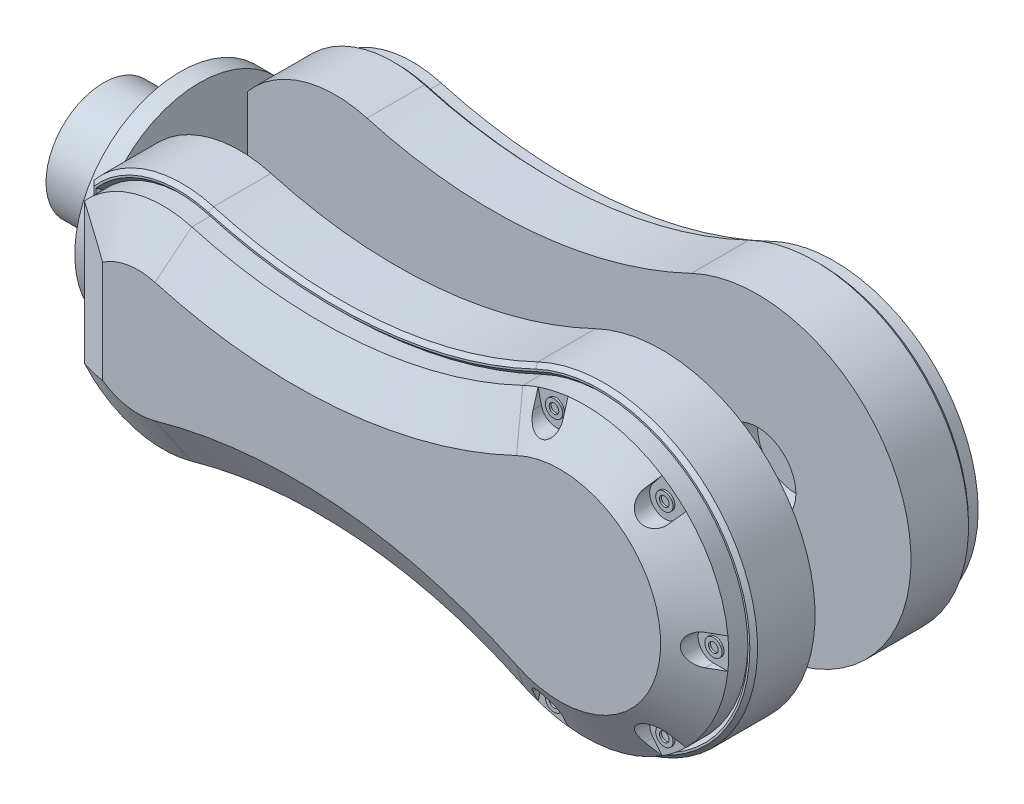
from build123d import *

# Parameters (mm, degrees)
SKETCH1_R                 = 27.5
BOSS_EXTRUDE1_DEPTH       = 5
BOSS_EXTRUDE2_DEPTH       = 15
BOSS_EXTRUDE3_DEPTH       = 5
BOSS_EXTRUDE4_DEPTH       = 1
BOSS_EXTRUDE4_DRAFT       = 45
BOSS_EXTRUDE5_DEPTH       = 6.5
BOSS_EXTRUDE5_TAPER       = 60
CUT_EXTRUDE1_START        = -6.5
CUT_EXTRUDE1_DEPTH        = 6.5
SKETCH10_R                = 2.25
SKETCH10_R_2              = 1.25
BOSS_EXTRUDE6_DEPTH       = 0.5
CIRPATTERN1_COUNT         = 7
MIRROR1_COPY_1_DEPTH      = 1
MIRROR1_COPY_1_DRAFT      = 45
MIRROR1_START             = -6.5
MIRROR1_COPY_2_DEPTH      = 6.5
MIRROR1_COPY_3_DEPTH      = 6.5
MIRROR1_COPY_4_DEPTH      = 6.5
MIRROR1_COPY_5_DEPTH      = 6.5
MIRROR1_COPY_6_SKETCH_R   = 2.25
MIRROR1_COPY_6_SKETCH_R_2 = 1.25
MIRROR1_COPY_6_DEPTH      = 0.5
MIRROR1_COPY_7_SKETCH_R   = 2.25
MIRROR1_COPY_7_SKETCH_R_2 = 1.25
MIRROR1_COPY_7_DEPTH      = 0.5
MIRROR1_COPY_8_SKETCH_R   = 2.25
MIRROR1_COPY_8_SKETCH_R_2 = 1.25
MIRROR1_COPY_8_DEPTH      = 0.5
MIRROR1_COPY_9_SKETCH_R   = 2.25
MIRROR1_COPY_9_SKETCH_R_2 = 1.25
MIRROR1_COPY_9_DEPTH      = 0.5
SKETCH11_R                = 15
BOSS_EXTRUDE7_DEPTH       = 20
SKETCH12_R                = 10
CUT_EXTRUDE2_DEPTH        = 10


with BuildPart() as part:
    # Sketch1 → Boss-Extrude1 (new body)
    with BuildSketch(Plane(origin=(0, 0, 0), x_dir=(0, 0, -1), z_dir=(1, 0, 0))):
        Circle(SKETCH1_R)
    extrude(amount=BOSS_EXTRUDE1_DEPTH)

    # Sketch2 → Boss-Extrude2 (add)
    with BuildSketch(Plane.XY.offset(27.5)):
        with BuildLine():
            Line((5, -19.261360284), (5, 19.261360284))
            ThreePointArc((5, 19.261360284), (19.171565327, 28.671566773), (36.181818182, 28.862741575))
            ThreePointArc((36.181818182, 28.862741575), (79.113611055, 24.748379421), (120.727272727, 36.078426969))
            ThreePointArc((120.727272727, 36.078426969), (178, 0), (120.727272727, -36.078426969))
            ThreePointArc((120.727272727, -36.078426969), (79.113611055, -24.748379421), (36.181818182, -28.862741575))
            ThreePointArc((36.181818182, -28.862741575), (19.171565327, -28.671566773), (5, -19.261360284))
        make_face()
    boss_extrude2 = extrude(amount=-BOSS_EXTRUDE2_DEPTH)

    # Sketch3 → Boss-Extrude3 (add)
    with BuildSketch(Plane.XY.offset(27.5)):
        with BuildLine():
            Line((7.5, 18.33030278), (7.5, 0))
            Line((7.5, 0), (7.5, -18.33030278))
            ThreePointArc((7.5, -18.33030278), (20.334304536, -26.409981315), (35.5, -26.457513111))
            ThreePointArc((35.5, -26.457513111), (79.326205225, -22.257435078), (121.806818182, -33.823525283))
            ThreePointArc((121.806818182, -33.823525283), (175.5, 0), (121.806818182, 33.823525283))
            ThreePointArc((121.806818182, 33.823525283), (79.326205225, 22.257435078), (35.5, 26.457513111))
            ThreePointArc((35.5, 26.457513111), (20.334304536, 26.409981315), (7.5, 18.33030278))
        make_face()
    boss_extrude3 = extrude(amount=BOSS_EXTRUDE3_DEPTH)


with BuildPart() as boss_extrude4_tool:
    # Sketch7 → Boss-Extrude4 (with draft: the straight prism first)
    with BuildSketch(Plane.XY.offset(27.5)):
        with BuildLine():
            Line((5, 19.261360284), (5, 0))
            Line((5, 0), (5, -19.261360284))
            ThreePointArc((5, -19.261360284), (19.171565327, -28.671566773), (36.181818182, -28.862741575))
            ThreePointArc((36.181818182, -28.862741575), (79.113611055, -24.748379421), (120.727272727, -36.078426969))
            ThreePointArc((120.727272727, -36.078426969), (178, 0), (120.727272727, 36.078426969))
            ThreePointArc((120.727272727, 36.078426969), (79.113611055, 24.748379421), (36.181818182, 28.862741575))
            ThreePointArc((36.181818182, 28.862741575), (19.171565327, 28.671566773), (5, 19.261360284))
        make_face()
        with BuildLine():
            Line((7.5, 18.33030278), (7.5, -18.33030278))
            ThreePointArc((7.5, -18.33030278), (20.334304536, -26.409981315), (35.5, -26.457513111))
            ThreePointArc((35.5, -26.457513111), (79.326205225, -22.257435078), (121.806818182, -33.823525283))
            ThreePointArc((121.806818182, -33.823525283), (175.5, 0), (121.806818182, 33.823525283))
            ThreePointArc((121.806818182, 33.823525283), (79.326205225, 22.257435078), (35.5, 26.457513111))
            ThreePointArc((35.5, 26.457513111), (20.334304536, 26.409981315), (7.5, 18.33030278))
        make_face(mode=Mode.SUBTRACT)
    extrude(amount=BOSS_EXTRUDE4_DEPTH)
    # Boss-Extrude4: the draft: its side faces are tilted about the plane it starts from
    boss_extrude4_sides = [boss_extrude4_tool.faces().sort_by_distance(p)[0] for p in [
        (79.113611055, 24.748379421, 28),
        (7.5, 0, 28),
        (20.334304536, -26.409981315, 28),
        (79.326205225, -22.257435078, 28),
        (175.5, 0, 28),
        (79.326205225, 22.257435078, 28),
        (20.334304536, 26.409981315, 28),
        (79.113611055, -24.748379421, 28),
        (19.171565327, -28.671566773, 28),
        (5, 0, 28),
        (19.171565327, 28.671566773, 28),
        (178, 0, 28),
    ]]
    draft(boss_extrude4_sides, Plane.XY.offset(27.5), BOSS_EXTRUDE4_DRAFT)


with BuildPart() as part_1:
    add(part.part)

    # Boss-Extrude4: add boss_extrude4_tool
    add(boss_extrude4_tool.part)

    # Sketch8 → Boss-Extrude5 (add)
    with BuildSketch(Plane.XY.offset(32.5)):
        with BuildLine():
            Line((7.5, 18.33030278), (7.5, -18.33030278))
            ThreePointArc((7.5, -18.33030278), (20.334304536, -26.409981315), (35.5, -26.457513111))
            ThreePointArc((35.5, -26.457513111), (79.326205225, -22.257435078), (121.806818182, -33.823525283))
            ThreePointArc((121.806818182, -33.823525283), (175.5, 0), (121.806818182, 33.823525283))
            ThreePointArc((121.806818182, 33.823525283), (79.326205225, 22.257435078), (35.5, 26.457513111))
            ThreePointArc((35.5, 26.457513111), (20.334304536, 26.409981315), (7.5, 18.33030278))
        make_face()
    boss_extrude5 = extrude(amount=BOSS_EXTRUDE5_DEPTH, taper=BOSS_EXTRUDE5_TAPER)

    # Sketch9 → Cut-Extrude1 (cut)
    with BuildSketch(Plane.XY.offset(39).offset(CUT_EXTRUDE1_START)):
        with BuildLine():
            ThreePointArc((171.5, 4), (168.671572875, 2.828427125), (167.5, 0))
            Line((167.5, 0), (175.5, 0))
            ThreePointArc((175.5, 0), (175.446475896, 2.002858699), (175.286056375, 4))
            Line((175.286056375, 4), (171.5, 4))
        make_face()
        with BuildLine():
            Line((175.5, 0), (167.5, 0))
            ThreePointArc((167.5, 0), (168.671572875, -2.828427125), (171.5, -4))
            Line((171.5, -4), (175.286056375, -4))
            ThreePointArc((175.286056375, -4), (175.446475896, -2.002858699), (175.5, 0))
        make_face()
        with BuildLine():
            ThreePointArc((175.286056375, 4), (175.446475896, 2.002858699), (175.5, 0))
            Line((175.5, 0), (176.247593881, 0))
            Line((176.247593881, 0), (176.247593881, 4))
            Line((176.247593881, 4), (175.286056375, 4))
        make_face()
        with BuildLine():
            Line((176.247593881, 0), (175.5, 0))
            ThreePointArc((175.5, 0), (175.446475896, -2.002858699), (175.286056375, -4))
            Line((175.286056375, -4), (176.247593881, -4))
            Line((176.247593881, -4), (176.247593881, 0))
        make_face()
    cut_extrude1 = extrude(amount=CUT_EXTRUDE1_DEPTH, mode=Mode.SUBTRACT)

    # Sketch10 → Boss-Extrude6 (add)
    with BuildSketch(Plane.XY.offset(32.5)):
        with Locations((172, 0)):
            Circle(SKETCH10_R)
        with Locations((172, 0)):
            Circle(SKETCH10_R_2, mode=Mode.SUBTRACT)
    boss_extrude6 = extrude(amount=BOSS_EXTRUDE6_DEPTH)

    # CirPattern1: Cut-Extrude1, Boss-Extrude6 ×7 about axis, 2 skipped
    cirpattern1_axis = Axis((138, 0, 0), (0, 0, 1))
    add([cut_extrude1.rotate(cirpattern1_axis, i * 360 / CIRPATTERN1_COUNT) for i in range(1, CIRPATTERN1_COUNT) if i not in (3, 4)], mode=Mode.SUBTRACT)
    add([boss_extrude6.rotate(cirpattern1_axis, i * 360 / CIRPATTERN1_COUNT) for i in range(1, CIRPATTERN1_COUNT) if i not in (3, 4)])

    # Mirror1: Boss-Extrude2, Boss-Extrude3, Boss-Extrude5, Cut-Extrude1, Boss-Extrude6 across plane
    add(boss_extrude2.mirror(Plane.XY))
    add(boss_extrude3.mirror(Plane.XY))
    add(boss_extrude5.mirror(Plane.XY))
    add(cut_extrude1.mirror(Plane.XY), mode=Mode.SUBTRACT)
    add(boss_extrude6.mirror(Plane.XY))


with BuildPart() as mirror1_copy_1_tool:
    # Mirror1 copy 1 sketch → Mirror1 copy 1 (with draft: the straight prism first)
    with BuildSketch(Plane(origin=(0, 0, -27.5), x_dir=(1, 0, 0), z_dir=(0, 0, -1))):
        with BuildLine():
            Line((5, -19.261360284), (5, 0))
            Line((5, 0), (5, 19.261360284))
            ThreePointArc((5, 19.261360284), (19.171565327, 28.671566773), (36.181818182, 28.862741575))
            ThreePointArc((36.181818182, 28.862741575), (79.113611055, 24.748379421), (120.727272727, 36.078426969))
            ThreePointArc((120.727272727, 36.078426969), (178, 0), (120.727272727, -36.078426969))
            ThreePointArc((120.727272727, -36.078426969), (79.113611055, -24.748379421), (36.181818182, -28.862741575))
            ThreePointArc((36.181818182, -28.862741575), (19.171565327, -28.671566773), (5, -19.261360284))
        make_face()
        with BuildLine():
            Line((7.5, -18.33030278), (7.5, 18.33030278))
            ThreePointArc((7.5, 18.33030278), (20.334304536, 26.409981315), (35.5, 26.457513111))
            ThreePointArc((35.5, 26.457513111), (79.326205225, 22.257435078), (121.806818182, 33.823525283))
            ThreePointArc((121.806818182, 33.823525283), (175.5, 0), (121.806818182, -33.823525283))
            ThreePointArc((121.806818182, -33.823525283), (79.326205225, -22.257435078), (35.5, -26.457513111))
            ThreePointArc((35.5, -26.457513111), (20.334304536, -26.409981315), (7.5, -18.33030278))
        make_face(mode=Mode.SUBTRACT)
    extrude(amount=MIRROR1_COPY_1_DEPTH)
    # Mirror1 copy 1: the draft: its side faces are tilted about the plane it starts from
    mirror1_copy_1_sides = [mirror1_copy_1_tool.faces().sort_by_distance(p)[0] for p in [
        (79.113611055, 24.748379421, -28),
        (7.5, 0, -28),
        (20.334304536, -26.409981315, -28),
        (79.326205225, -22.257435078, -28),
        (175.5, 0, -28),
        (79.326205225, 22.257435078, -28),
        (20.334304536, 26.409981315, -28),
        (79.113611055, -24.748379421, -28),
        (19.171565327, -28.671566773, -28),
        (5, 0, -28),
        (19.171565327, 28.671566773, -28),
        (178, 0, -28),
    ]]
    draft(mirror1_copy_1_sides, Plane(origin=(0, 0, -27.5), x_dir=(1, 0, 0), z_dir=(0, 0, -1)), MIRROR1_COPY_1_DRAFT)


with BuildPart() as part_2:
    add(part_1.part)

    # Mirror1 copy 1: add mirror1_copy_1_tool
    add(mirror1_copy_1_tool.part)

    # Mirror1 copy 2 sketch → Mirror1 copy 2 (cut)
    with BuildSketch(Plane(origin=(51.958407343, -107.892744581, -39), x_dir=(0.6234898018587336, 0.7818314824680298, 0), z_dir=(0, 0, -1)).offset(MIRROR1_START)):
        with BuildLine():
            ThreePointArc((171.5, -4), (168.671572875, -2.828427125), (167.5, 0))
            Line((167.5, 0), (175.5, 0))
            ThreePointArc((175.5, 0), (175.446475896, -2.002858699), (175.286056375, -4))
            Line((175.286056375, -4), (171.5, -4))
        make_face()
        with BuildLine():
            Line((175.5, 0), (167.5, 0))
            ThreePointArc((167.5, 0), (168.671572875, 2.828427125), (171.5, 4))
            Line((171.5, 4), (175.286056375, 4))
            ThreePointArc((175.286056375, 4), (175.446475896, 2.002858699), (175.5, 0))
        make_face()
        with BuildLine():
            ThreePointArc((175.286056375, -4), (175.446475896, -2.002858699), (175.5, 0))
            Line((175.5, 0), (176.247593881, 0))
            Line((176.247593881, 0), (176.247593881, -4))
            Line((176.247593881, -4), (175.286056375, -4))
        make_face()
        with BuildLine():
            Line((176.247593881, 0), (175.5, 0))
            ThreePointArc((175.5, 0), (175.446475896, 2.002858699), (175.286056375, 4))
            Line((175.286056375, 4), (176.247593881, 4))
            Line((176.247593881, 4), (176.247593881, 0))
        make_face()
    extrude(amount=MIRROR1_COPY_2_DEPTH, mode=Mode.SUBTRACT)

    # Mirror1 copy 3 sketch → Mirror1 copy 3 (cut)
    with BuildSketch(Plane(origin=(168.707888886, -134.540051881, -39), x_dir=(-0.22252093395631434, 0.9749279121818236, 0), z_dir=(0, 0, -1)).offset(MIRROR1_START)):
        with BuildLine():
            ThreePointArc((171.5, -4), (168.671572875, -2.828427125), (167.5, 0))
            Line((167.5, 0), (175.5, 0))
            ThreePointArc((175.5, 0), (175.446475896, -2.002858699), (175.286056375, -4))
            Line((175.286056375, -4), (171.5, -4))
        make_face()
        with BuildLine():
            Line((175.5, 0), (167.5, 0))
            ThreePointArc((167.5, 0), (168.671572875, 2.828427125), (171.5, 4))
            Line((171.5, 4), (175.286056375, 4))
            ThreePointArc((175.286056375, 4), (175.446475896, 2.002858699), (175.5, 0))
        make_face()
        with BuildLine():
            ThreePointArc((175.286056375, -4), (175.446475896, -2.002858699), (175.5, 0))
            Line((175.5, 0), (176.247593881, 0))
            Line((176.247593881, 0), (176.247593881, -4))
            Line((176.247593881, -4), (175.286056375, -4))
        make_face()
        with BuildLine():
            Line((176.247593881, 0), (175.5, 0))
            ThreePointArc((175.5, 0), (175.446475896, 2.002858699), (175.286056375, 4))
            Line((175.286056375, 4), (176.247593881, 4))
            Line((176.247593881, 4), (176.247593881, 0))
        make_face()
    extrude(amount=MIRROR1_COPY_3_DEPTH, mode=Mode.SUBTRACT)

    # Mirror1 copy 4 sketch → Mirror1 copy 4 (cut)
    with BuildSketch(Plane(origin=(168.707888886, 134.540051881, -39), x_dir=(-0.2225209339563137, -0.9749279121818237, 0), z_dir=(0, 0, -1)).offset(MIRROR1_START)):
        with BuildLine():
            ThreePointArc((171.5, -4), (168.671572875, -2.828427125), (167.5, 0))
            Line((167.5, 0), (175.5, 0))
            ThreePointArc((175.5, 0), (175.446475896, -2.002858699), (175.286056375, -4))
            Line((175.286056375, -4), (171.5, -4))
        make_face()
        with BuildLine():
            Line((175.5, 0), (167.5, 0))
            ThreePointArc((167.5, 0), (168.671572875, 2.828427125), (171.5, 4))
            Line((171.5, 4), (175.286056375, 4))
            ThreePointArc((175.286056375, 4), (175.446475896, 2.002858699), (175.5, 0))
        make_face()
        with BuildLine():
            ThreePointArc((175.286056375, -4), (175.446475896, -2.002858699), (175.5, 0))
            Line((175.5, 0), (176.247593881, 0))
            Line((176.247593881, 0), (176.247593881, -4))
            Line((176.247593881, -4), (175.286056375, -4))
        make_face()
        with BuildLine():
            Line((176.247593881, 0), (175.5, 0))
            ThreePointArc((175.5, 0), (175.446475896, 2.002858699), (175.286056375, 4))
            Line((175.286056375, 4), (176.247593881, 4))
            Line((176.247593881, 4), (176.247593881, 0))
        make_face()
    extrude(amount=MIRROR1_COPY_4_DEPTH, mode=Mode.SUBTRACT)

    # Mirror1 copy 5 sketch → Mirror1 copy 5 (cut)
    with BuildSketch(Plane(origin=(51.958407343, 107.892744581, -39), x_dir=(0.6234898018587334, -0.7818314824680299, 0), z_dir=(0, 0, -1)).offset(MIRROR1_START)):
        with BuildLine():
            ThreePointArc((171.5, -4), (168.671572875, -2.828427125), (167.5, 0))
            Line((167.5, 0), (175.5, 0))
            ThreePointArc((175.5, 0), (175.446475896, -2.002858699), (175.286056375, -4))
            Line((175.286056375, -4), (171.5, -4))
        make_face()
        with BuildLine():
            Line((175.5, 0), (167.5, 0))
            ThreePointArc((167.5, 0), (168.671572875, 2.828427125), (171.5, 4))
            Line((171.5, 4), (175.286056375, 4))
            ThreePointArc((175.286056375, 4), (175.446475896, 2.002858699), (175.5, 0))
        make_face()
        with BuildLine():
            ThreePointArc((175.286056375, -4), (175.446475896, -2.002858699), (175.5, 0))
            Line((175.5, 0), (176.247593881, 0))
            Line((176.247593881, 0), (176.247593881, -4))
            Line((176.247593881, -4), (175.286056375, -4))
        make_face()
        with BuildLine():
            Line((176.247593881, 0), (175.5, 0))
            ThreePointArc((175.5, 0), (175.446475896, 2.002858699), (175.286056375, 4))
            Line((175.286056375, 4), (176.247593881, 4))
            Line((176.247593881, 4), (176.247593881, 0))
        make_face()
    extrude(amount=MIRROR1_COPY_5_DEPTH, mode=Mode.SUBTRACT)

    # Mirror1 copy 6 sketch → Mirror1 copy 6 (add)
    with BuildSketch(Plane(origin=(51.958407343, -107.892744581, -32.5), x_dir=(0.6234898018587336, 0.7818314824680298, 0), z_dir=(0, 0, -1))):
        with Locations((172, 0)):
            Circle(MIRROR1_COPY_6_SKETCH_R)
        with Locations((172, 0)):
            Circle(MIRROR1_COPY_6_SKETCH_R_2, mode=Mode.SUBTRACT)
    extrude(amount=MIRROR1_COPY_6_DEPTH)

    # Mirror1 copy 7 sketch → Mirror1 copy 7 (add)
    with BuildSketch(Plane(origin=(168.707888886, -134.540051881, -32.5), x_dir=(-0.22252093395631434, 0.9749279121818236, 0), z_dir=(0, 0, -1))):
        with Locations((172, 0)):
            Circle(MIRROR1_COPY_7_SKETCH_R)
        with Locations((172, 0)):
            Circle(MIRROR1_COPY_7_SKETCH_R_2, mode=Mode.SUBTRACT)
    extrude(amount=MIRROR1_COPY_7_DEPTH)

    # Mirror1 copy 8 sketch → Mirror1 copy 8 (add)
    with BuildSketch(Plane(origin=(168.707888886, 134.540051881, -32.5), x_dir=(-0.2225209339563137, -0.9749279121818237, 0), z_dir=(0, 0, -1))):
        with Locations((172, 0)):
            Circle(MIRROR1_COPY_8_SKETCH_R)
        with Locations((172, 0)):
            Circle(MIRROR1_COPY_8_SKETCH_R_2, mode=Mode.SUBTRACT)
    extrude(amount=MIRROR1_COPY_8_DEPTH)

    # Mirror1 copy 9 sketch → Mirror1 copy 9 (add)
    with BuildSketch(Plane(origin=(51.958407343, 107.892744581, -32.5), x_dir=(0.6234898018587334, -0.7818314824680299, 0), z_dir=(0, 0, -1))):
        with Locations((172, 0)):
            Circle(MIRROR1_COPY_9_SKETCH_R)
        with Locations((172, 0)):
            Circle(MIRROR1_COPY_9_SKETCH_R_2, mode=Mode.SUBTRACT)
    extrude(amount=MIRROR1_COPY_9_DEPTH)

    # Sketch11 → Boss-Extrude7 (add)
    with BuildSketch(Plane.ZY):
        Circle(SKETCH11_R)
    extrude(amount=BOSS_EXTRUDE7_DEPTH)

    # Sketch12 → Cut-Extrude2 (cut)
    with BuildSketch(Plane.XY.offset(-12.5)):
        with Locations((138, 0)):
            Circle(SKETCH12_R)
    extrude(amount=-CUT_EXTRUDE2_DEPTH, mode=Mode.SUBTRACT)


solid = part_2.part
